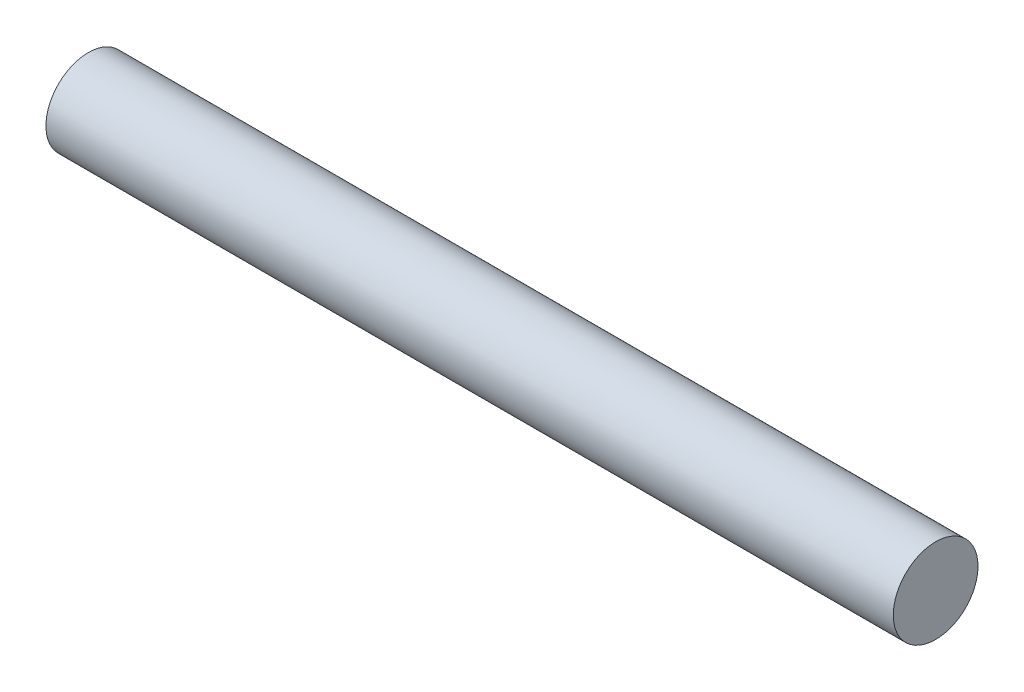
from build123d import *

# Parameters (mm, degrees)
SKETCH_1_R      = 25
EXTRUDE_1_DEPTH = 500


with BuildPart() as part:
    # 草图1 → 凸台-拉伸1 (new body)
    with BuildSketch(Plane(origin=(0, 0, 0), x_dir=(0, 0, -1), z_dir=(1, 0, 0))):
        Circle(SKETCH_1_R)
    extrude(amount=EXTRUDE_1_DEPTH)


solid = part.part
